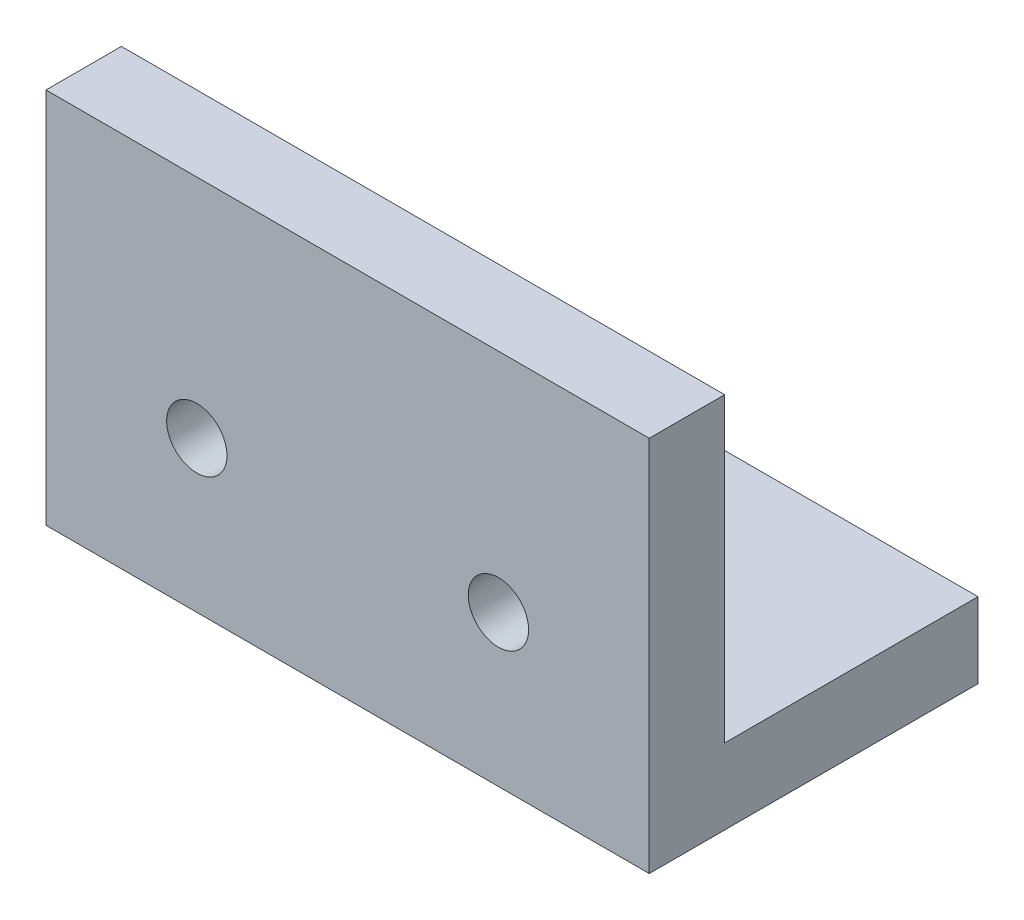
from build123d import *

# Parameters (mm, degrees)
BOSS_EXTRUDE1_DEPTH = 25.4
SKETCH2_R           = 1.27
CUT_EXTRUDE1_DEPTH  = 25.4


with BuildPart() as part:
    # Sketch1 → Boss-Extrude1 (new body)
    with BuildSketch(Plane(origin=(0, 0, 0), x_dir=(0, 0, -1), z_dir=(1, 0, 0))):
        Polygon((0, 0), (0, 12.7), (-3.175, 12.7), (-3.175, -3.175), (10.668, -3.175), (10.668, 0), align=None)
    extrude(amount=BOSS_EXTRUDE1_DEPTH)

    # Sketch2 → Cut-Extrude1 (cut)
    with BuildSketch(Plane.XY.offset(3.175)):
        with Locations((6.35, 3.175)):
            Circle(SKETCH2_R)
        with Locations((19.05, 3.175)):
            Circle(SKETCH2_R)
    extrude(amount=-CUT_EXTRUDE1_DEPTH, mode=Mode.SUBTRACT)


solid = part.part
